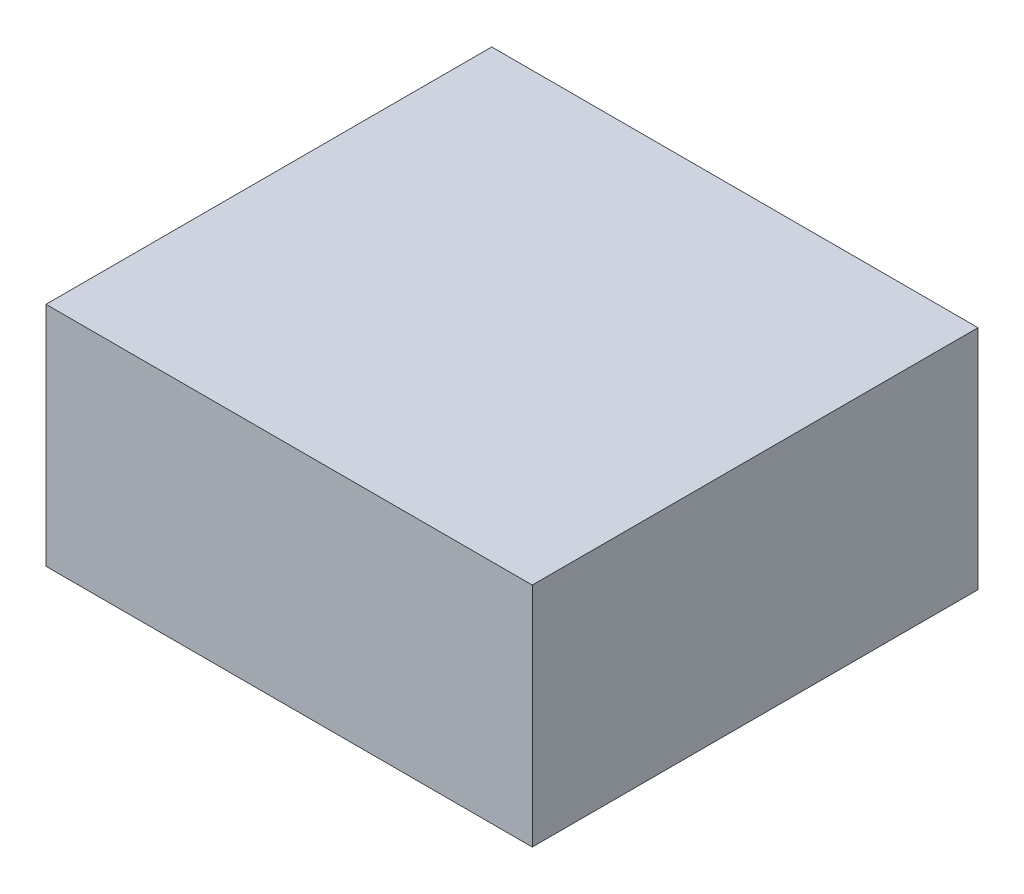
from build123d import *

# Parameters (mm, degrees)
SKETCH_1_W      = 120
SKETCH_1_H      = 110
EXTRUDE_1_DEPTH = 56


with BuildPart() as part:
    # 草图1 → 凸台-拉伸1 (new body)
    with BuildSketch(Plane(origin=(0, 0, 0), x_dir=(1, 0, 0), z_dir=(0, 1, 0))):
        Rectangle(SKETCH_1_W, SKETCH_1_H)
    extrude(amount=EXTRUDE_1_DEPTH)


solid = part.part
